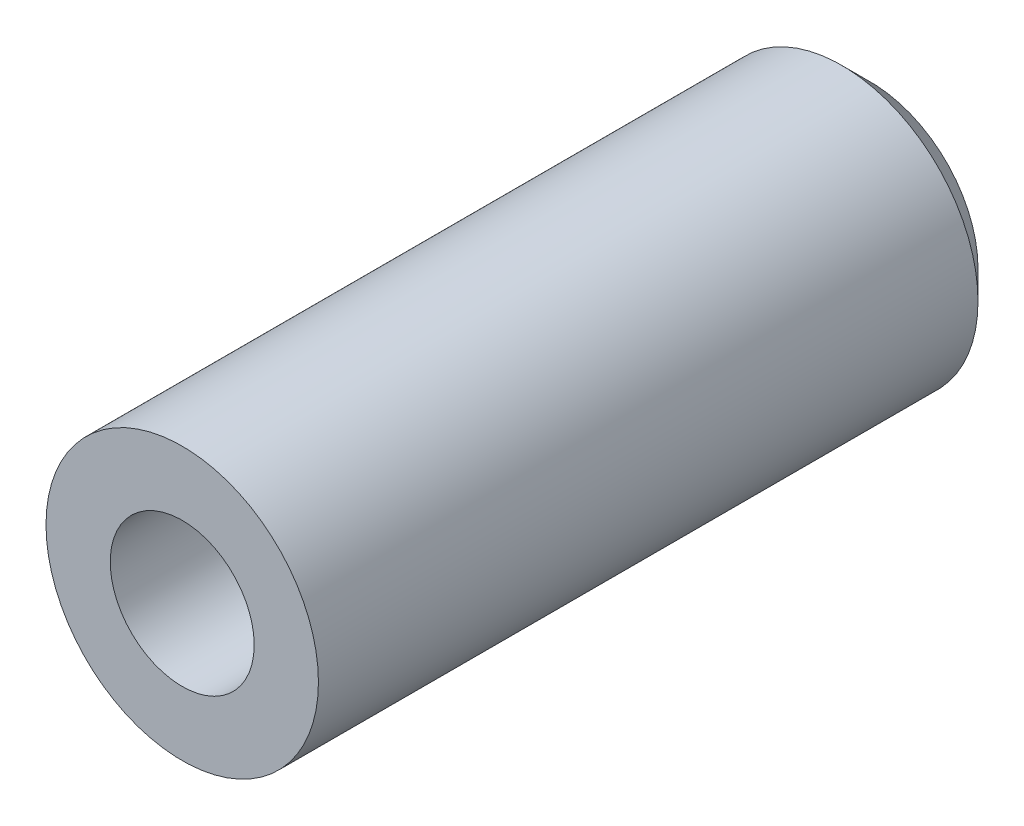
from build123d import *


with BuildPart() as part:
    # Sketch3 → Revolve1 (revolve)
    with BuildSketch(Plane(origin=(0, 0, 0), x_dir=(1, 0, 0), z_dir=(0, 1, 0))):
        Polygon((1.255, 0), (1.255, 12), (1.875, 12), (2.375, 11.5), (2.375, 0), align=None)
    revolve(axis=Axis((0, 0, 0), (0, 0, -1)))


solid = part.part
